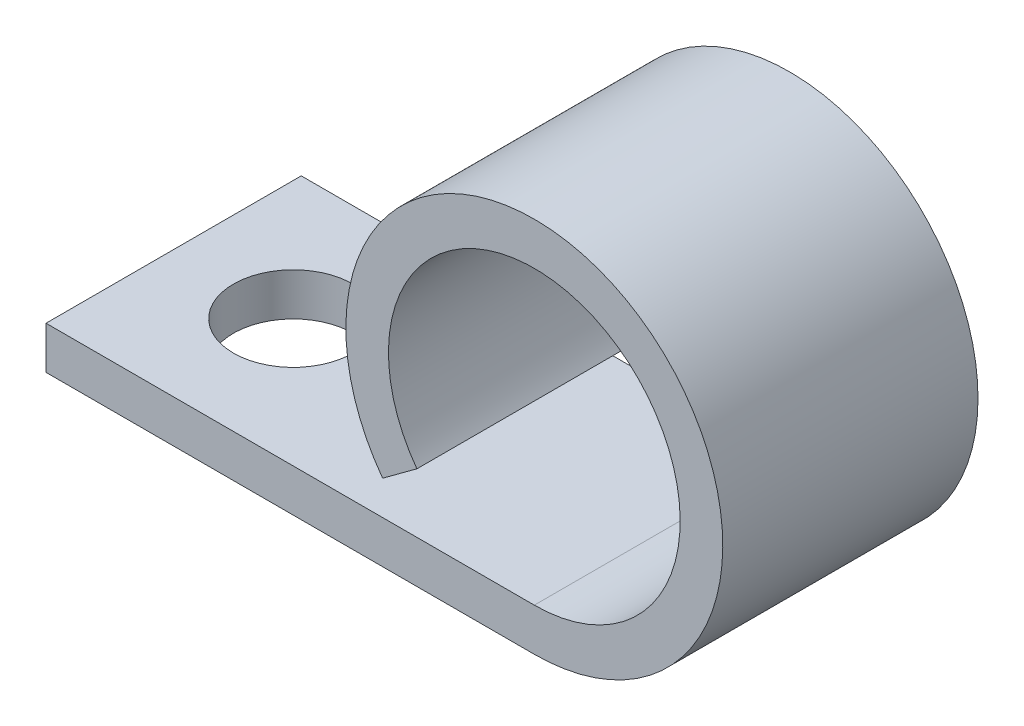
from build123d import *

# Parameters (mm, degrees)
BOSS_EXTRUDE1_DEPTH = 5.55625
SKETCH2_R           = 2.6035
CUT_EXTRUDE1_DEPTH  = 27.356702141


with BuildPart() as part:
    # Sketch1 → Boss-Extrude1 (new, symmetric)
    with BuildSketch(Plane.XY):
        with BuildLine():
            Line((-21.2598, -8.2042), (0, -8.2042))
            ThreePointArc((0, -8.2042), (3.700135792, 7.322423968), (-6.604900662, -4.86664))
            Line((-6.604900662, -4.86664), (-5.112152215, -3.766749226))
            ThreePointArc((-5.112152215, -3.766749226), (2.863882192, 5.667510811), (0, -6.35))
            Line((0, -6.35), (-21.2598, -6.35))
            Line((-21.2598, -6.35), (-21.2598, -8.2042))
        make_face()
    extrude(amount=BOSS_EXTRUDE1_DEPTH, both=True)

    # Sketch2 → Cut-Extrude1 (cut, through all)
    with BuildSketch(Plane(origin=(0, -6.35, 0), x_dir=(1, 0, 0), z_dir=(0, 1, 0))):
        with Locations(Location((-16.0528, 0, 0), (0, 0, 270))):
            Circle(SKETCH2_R)
    extrude(amount=-CUT_EXTRUDE1_DEPTH, mode=Mode.SUBTRACT)


solid = part.part
